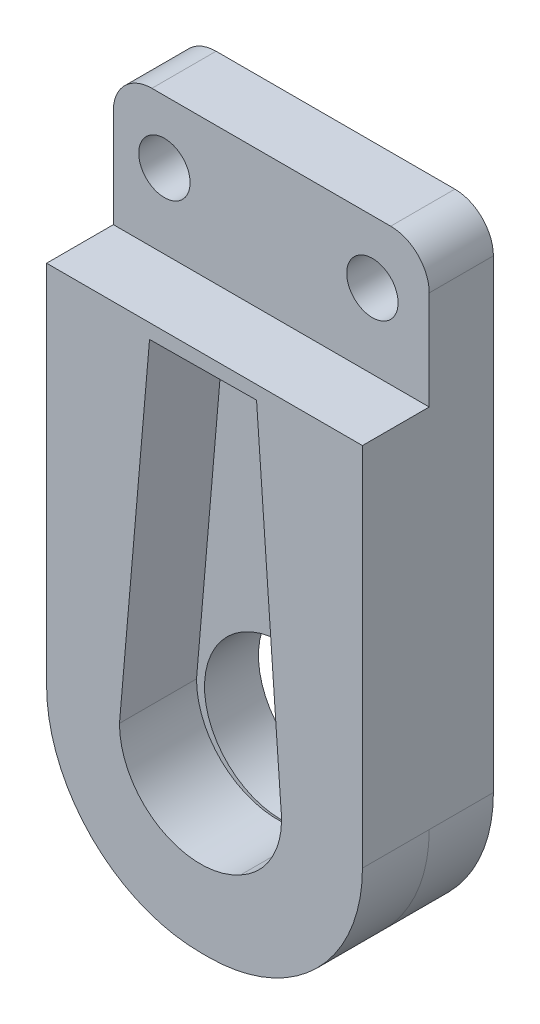
from build123d import *

# Parameters (mm, degrees)
BOSS_EXTRUDE1_DEPTH = 2.5
FILLET1_R           = 6
FILLET2_R           = 1.5
SKETCH3_R           = 0.9999999999999983
CUT_EXTRUDE1_DEPTH  = 3.5
SKETCH4_W           = 12.299999999999898
SKETCH4_H           = 20.25175916550927
BOSS_EXTRUDE2_DEPTH = 2.6
FILLET3_R           = 6
SKETCH5_R           = 2.9999999999999947
CUT_EXTRUDE2_DEPTH  = 406.0937861882827
CUT_EXTRUDE3_DEPTH  = 3


with BuildPart() as part:
    # Sketch2 → Boss-Extrude1 (new body)
    with BuildSketch(Plane.XY.offset(10)):
        Polygon((-326.0372348081085, 240.3636560028167), (-313.73723480810855, 240.3636560028167), (-313.7372348081086, 214.7636560028167), (-326.0372348081085, 214.7636560028167), align=None)
    extrude(amount=BOSS_EXTRUDE1_DEPTH)

    # Fillet1
    fillet1_edges = [part.edges().sort_by_distance(p)[0] for p in [
        (-313.7372348081086, 214.7636560028167, 11.25),
        (-326.0372348081085, 214.7636560028167, 11.25),
    ]]
    fillet(fillet1_edges, radius=FILLET1_R)

    # Fillet2
    fillet2_edges = [part.edges().sort_by_distance(p)[0] for p in [
        (-326.0372348081085, 240.3636560028167, 11.25),
        (-313.73723480810855, 240.3636560028167, 11.25),
    ]]
    fillet(fillet2_edges, radius=FILLET2_R)

    # Sketch3 → Cut-Extrude1 (cut)
    with BuildSketch(Plane.XY.offset(12.5)):
        with Locations((-324.0490905957561, 237.92231401546465)):
            Circle(SKETCH3_R)
        with Locations((-315.94909059575616, 237.92231401546465)):
            Circle(SKETCH3_R)
    extrude(amount=-CUT_EXTRUDE1_DEPTH, mode=Mode.SUBTRACT)

    # Sketch4 → Boss-Extrude2 (add)
    with BuildSketch(Plane.XY.offset(12.5)):
        with Locations((-319.8872348081086, 224.88953558557134)):
            Rectangle(SKETCH4_W, SKETCH4_H)
    extrude(amount=BOSS_EXTRUDE2_DEPTH)

    # Fillet3
    fillet3_edges = [part.edges().sort_by_distance(p)[0] for p in [
        (-313.7372348081086, 214.7636560028167, 13.8),
        (-326.0372348081085, 214.7636560028167, 13.8),
    ]]
    fillet(fillet3_edges, radius=FILLET3_R)

    # Sketch5 → Cut-Extrude2 (cut, through all)
    with BuildSketch(Plane.XY.offset(15.100000000000001)):
        with Locations((-319.88723480810853, 220.81205289784253)):
            Circle(SKETCH5_R)
    extrude(amount=-CUT_EXTRUDE2_DEPTH, mode=Mode.SUBTRACT)

    # Sketch6 → Cut-Extrude3 (cut)
    with BuildSketch(Plane.XY.offset(15.100000000000001)):
        with BuildLine():
            Line((-322.02823852882625, 234.448742964222), (-317.861572265625, 234.4860076904297))
            Line((-317.861572265625, 234.4860076904297), (-316.8882987164766, 220.89194231082783))
            ThreePointArc((-316.8882987164766, 220.89194231082783), (-320.05528422089077, 217.74800778171863), (-323.19921875, 220.9149932861328))
            Line((-323.19921875, 220.9149932861328), (-322.02823852882625, 234.448742964222))
        make_face()
    extrude(amount=-CUT_EXTRUDE3_DEPTH, mode=Mode.SUBTRACT)


solid = part.part
